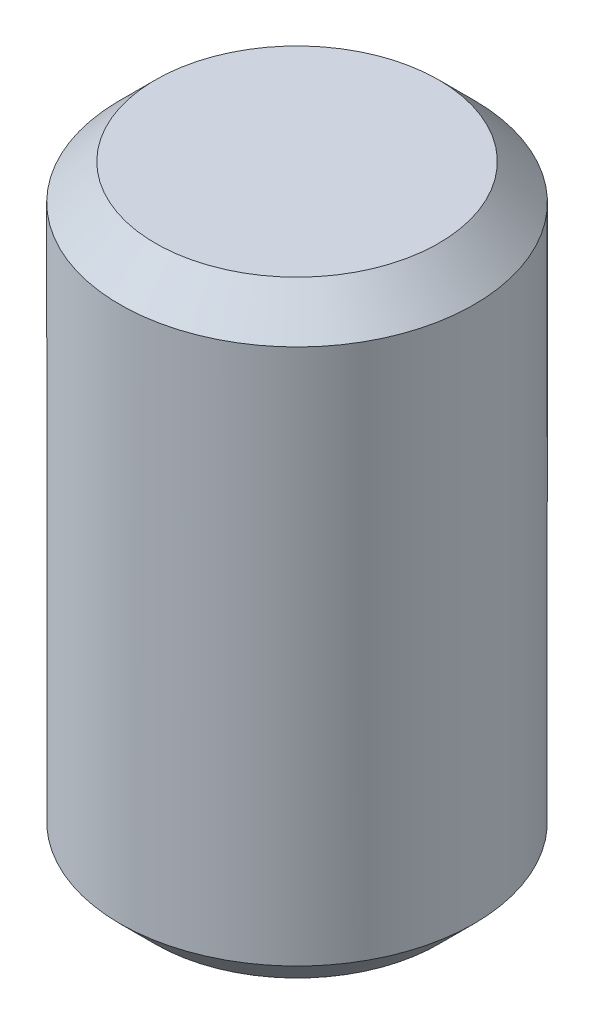
from build123d import *

# Parameters (mm, degrees)
SKETCH1_R           = 1.75
BOSS_EXTRUDE1_DEPTH = 6
CHAMFER1_SIZE       = 0.35


with BuildPart() as part:
    # Sketch1 → Boss-Extrude1 (new body)
    with BuildSketch(Plane(origin=(0, 0, 0), x_dir=(1, 0, 0), z_dir=(0, 1, 0))):
        with Locations(Location((0, 0, 0), (0, 0, 270))):
            Circle(SKETCH1_R)
    extrude(amount=BOSS_EXTRUDE1_DEPTH)

    # Chamfer1
    chamfer1_edges = [part.edges().sort_by_distance(p)[0] for p in [
        (0, 0, -1.75),
        (0, 6, -1.75),
    ]]
    chamfer(chamfer1_edges, length=CHAMFER1_SIZE)


solid = part.part
